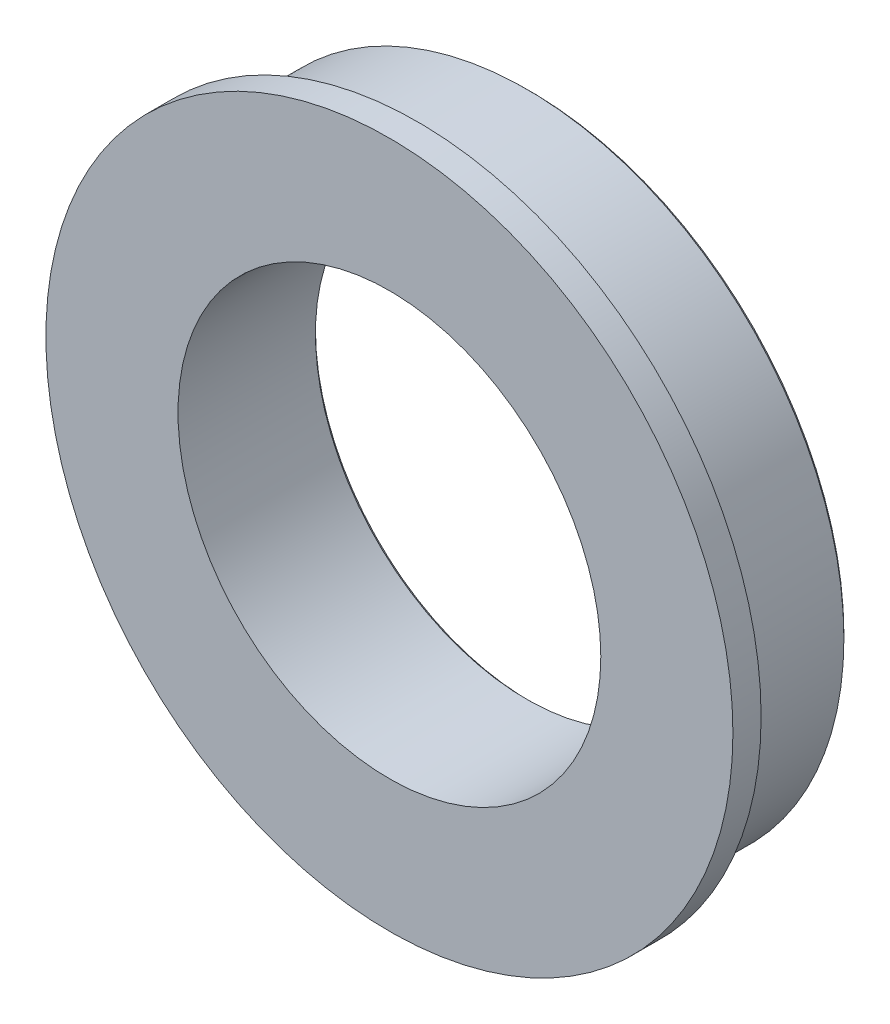
from build123d import *

# Parameters (mm, degrees)
SKETCH_1_R      = 9
SKETCH_1_R_2    = 6
EXTRUDE_1_DEPTH = 4
CHAMFER_1_SIZE  = 0.1
EXTRUDE_START   = -0.8
SKETCH_2_R      = 9.75
SKETCH_2_R_2    = 6
EXTRUDE_2_DEPTH = 0.8


with BuildPart() as part:
    # 草图1 → 凸台-拉伸1 (new body)
    with BuildSketch(Plane.XY):
        Circle(SKETCH_1_R)
        Circle(SKETCH_1_R_2, mode=Mode.SUBTRACT)
    extrude(amount=EXTRUDE_1_DEPTH)

    # 倒角1
    chamfer_1_edges = [part.edges().sort_by_distance(p)[0] for p in [
        (-9, 0, 0),
        (-6, 0, 0),
    ]]
    chamfer(chamfer_1_edges, length=CHAMFER_1_SIZE)

    # 草图2 → 凸台-拉伸2 (add)
    with BuildSketch(Plane.XY.offset(4).offset(EXTRUDE_START)):
        Circle(SKETCH_2_R)
        Circle(SKETCH_2_R_2, mode=Mode.SUBTRACT)
    extrude(amount=EXTRUDE_2_DEPTH)


solid = part.part
